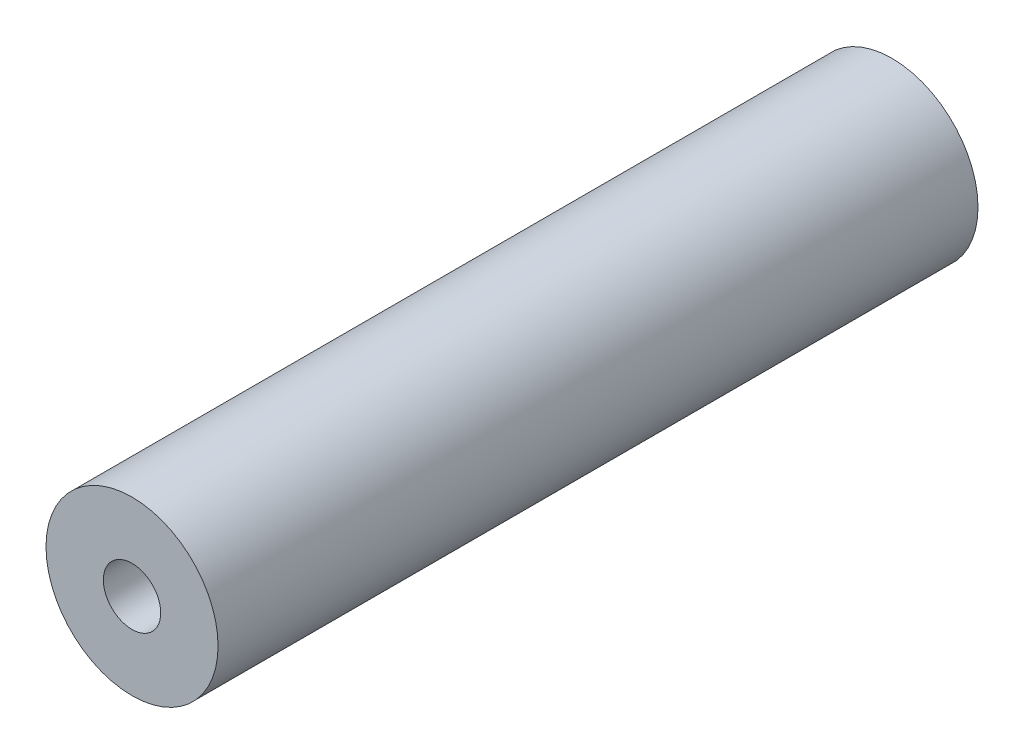
from build123d import *

# Parameters (mm, degrees)
SKETCH_1_R      = 3
SKETCH_1_R_2    = 1
EXTRUDE_1_DEPTH = 26.5


with BuildPart() as part:
    # Эскиз1 → Бобышка-Вытянуть1 (new body)
    with BuildSketch(Plane.XY):
        Circle(SKETCH_1_R)
        Circle(SKETCH_1_R_2, mode=Mode.SUBTRACT)
    extrude(amount=EXTRUDE_1_DEPTH)


solid = part.part
